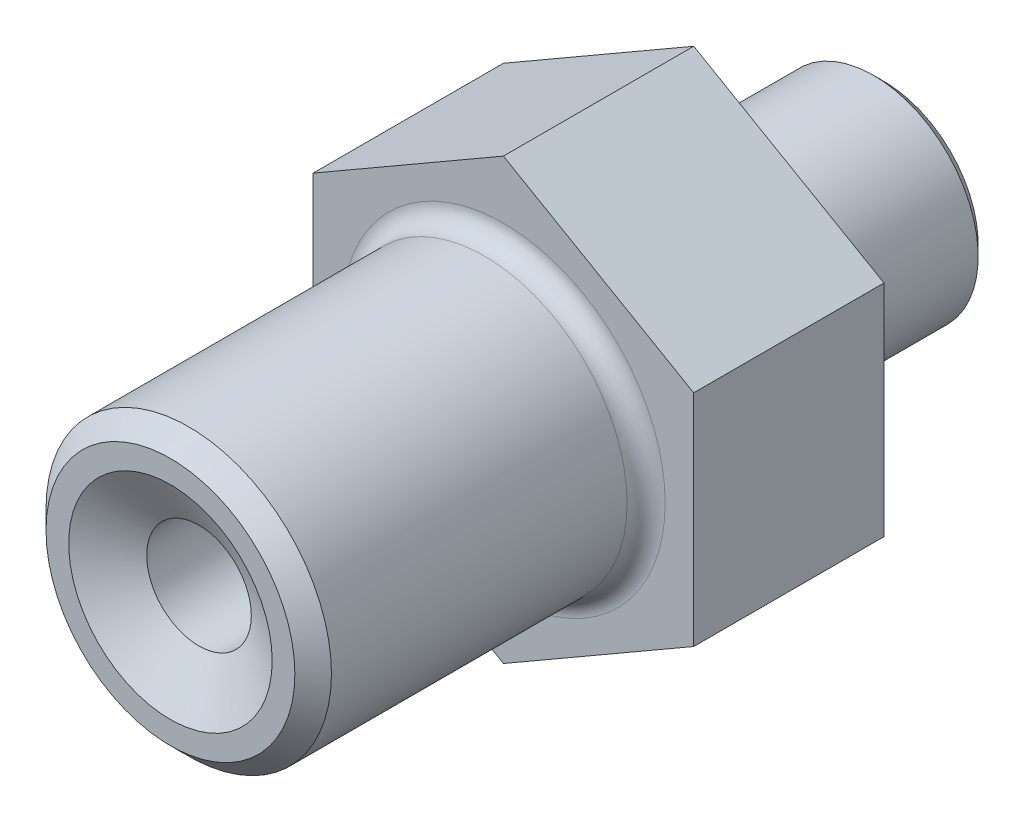
from build123d import *

# Parameters (mm, degrees)
SKETCH_1_R          = 17.5
EXTRUDE_1_DEPTH     = 20
SKETCH_2_R          = 15
EXTRUDE_2_DEPTH     = 35
SKETCH_3_R          = 11
EXTRUDE_3_DEPTH     = 20
CHAMFER_1_SIZE      = 1.1015
CUT_EXTRUDE_START   = 2
SKETCH_5_R          = 17.5
SKETCH_5_R_2        = 9.5
CUT_EXTRUDE_1_DEPTH = 2
CHAMFER_2_SIZE      = 1.921
FILLET_1_R          = 2
CHAMFER_3_SIZE      = 2
CHAMFER_3_SIZE2     = 1.154700538
SKETCH_6_R          = 17.5
EXTRUDE_4_DEPTH     = 20


with BuildPart() as part:
    # Эскиз1 → Бобышка-Вытянуть1 (new body)
    with BuildSketch(Plane.XY):
        Circle(SKETCH_1_R)
    extrude(amount=EXTRUDE_1_DEPTH)

    # Эскиз2 → Бобышка-Вытянуть2 (add)
    with BuildSketch(Plane.XY.offset(20)):
        Circle(SKETCH_2_R)
    extrude(amount=EXTRUDE_2_DEPTH)

    # Эскиз3 → Бобышка-Вытянуть3 (add)
    with BuildSketch(Plane(origin=(0, 0, 0), x_dir=(-1, 0, 0), z_dir=(0, 0, -1))):
        with Locations(Location((0, 0, 0), (0, 0, 180))):
            Circle(SKETCH_3_R)
    extrude(amount=EXTRUDE_3_DEPTH)

    # Эскиз4 → Вырез-Повернуть1 (revolve, cut)
    with BuildSketch(Plane(origin=(0, 0, 0), x_dir=(0, 0, -1), z_dir=(1, 0, 0)), mode=Mode.PRIVATE) as cut_revolve_1_sk:
        Polygon((-55, 0), (-55, 10.696152423), (-52, 5.5), (20, 5.5), (20, 0), align=None)
    revolve(cut_revolve_1_sk.sketch.rotate(Axis((0, 0, 55), (0, 0, -1)), 90), axis=Axis((0, 0, 55), (0, 0, -1)), mode=Mode.SUBTRACT)

    # Фаска1
    chamfer_1_edges = [part.edges().sort_by_distance(p)[0] for p in [
        (-11, 0, -20),
    ]]
    chamfer(chamfer_1_edges, length=CHAMFER_1_SIZE)

    # Эскиз5 → Вырез-Вытянуть1 (cut)
    with BuildSketch(Plane(origin=(0, 0, 0), x_dir=(-1, 0, 0), z_dir=(0, 0, -1)).offset(CUT_EXTRUDE_START)):
        with Locations(Location((0, 0, 0), (0, 0, 180))):
            Circle(SKETCH_5_R)
        Circle(SKETCH_5_R_2, mode=Mode.SUBTRACT)
    extrude(amount=-CUT_EXTRUDE_1_DEPTH, mode=Mode.SUBTRACT)

    # Фаска2
    chamfer_2_edges = [part.edges().sort_by_distance(p)[0] for p in [
        (-15, 0, 55),
    ]]
    chamfer(chamfer_2_edges, length=CHAMFER_2_SIZE)

    # Скругление1
    fillet_1_edges = [part.edges().sort_by_distance(p)[0] for p in [
        (-15, 0, 20),
    ]]
    fillet(fillet_1_edges, radius=FILLET_1_R)

    # Фаска3
    chamfer_3_edges = [part.edges().sort_by_distance(p)[0] for p in [
        (-5.5, 0, -20),
    ]]
    chamfer_3_side = [part.faces().sort_by_distance(p)[0] for p in [
        (-5.5, 0, 16),
    ]]
    chamfer(chamfer_3_edges, length=CHAMFER_3_SIZE, length2=CHAMFER_3_SIZE2, reference=chamfer_3_side[0])

    # Эскиз6 → Бобышка-Вытянуть4 (add)
    with BuildSketch(Plane(origin=(0, 0, 0), x_dir=(-1, 0, 0), z_dir=(0, 0, -1))):
        Polygon((0, 23.094010768), (-20, 11.547005384), (-20, -11.547005384), (0, -23.094010768), (20, -11.547005384), (20, 11.547005384), align=None)
        Circle(SKETCH_6_R, mode=Mode.SUBTRACT)
    extrude(amount=-EXTRUDE_4_DEPTH)


solid = part.part
